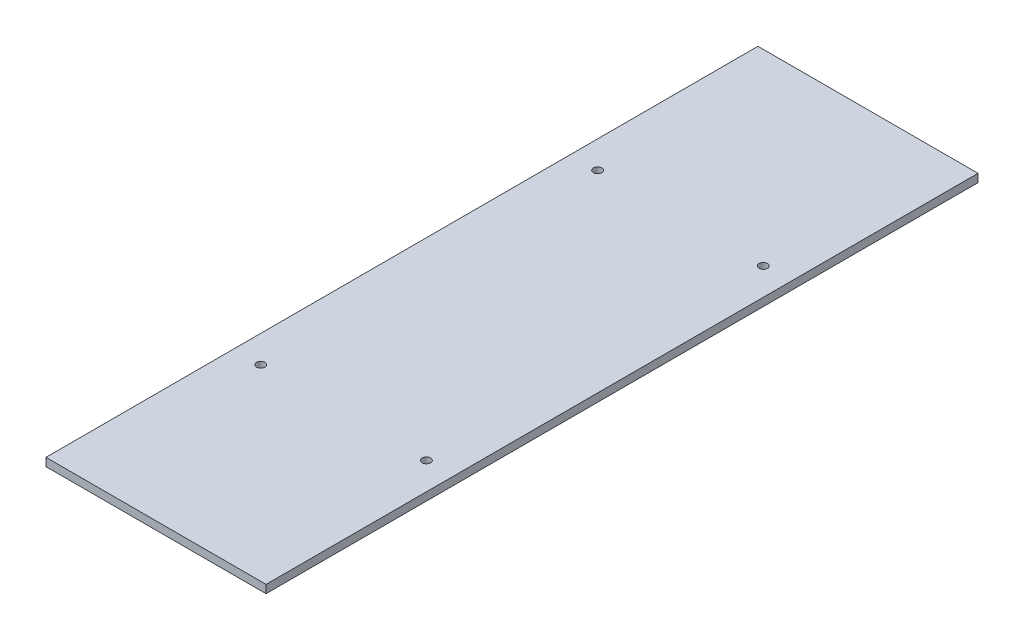
from build123d import *

# Parameters (mm, degrees)
SKETCH1_W           = 86.35
SKETCH1_H           = 279.4
SKETCH1_R           = 1.65
BOSS_EXTRUDE1_DEPTH = 3.175


with BuildPart() as part:
    # Sketch1 → Boss-Extrude1 (new body)
    with BuildSketch(Plane(origin=(0, 0, 0), x_dir=(1, 0, 0), z_dir=(0, 1, 0))):
        Rectangle(SKETCH1_W, SKETCH1_H)
        with Locations(Location((-32.5, 66.1, 0), (0, 0, 270))):
            Circle(SKETCH1_R, mode=Mode.SUBTRACT)
        with Locations(Location((32.5, 66.1, 0), (0, 0, 90))):
            Circle(SKETCH1_R, mode=Mode.SUBTRACT)
        with Locations(Location((32.5, -66.1, 0), (0, 0, 270))):
            Circle(SKETCH1_R, mode=Mode.SUBTRACT)
        with Locations(Location((-32.5, -66.1, 0), (0, 0, 90))):
            Circle(SKETCH1_R, mode=Mode.SUBTRACT)
    extrude(amount=BOSS_EXTRUDE1_DEPTH)


solid = part.part
